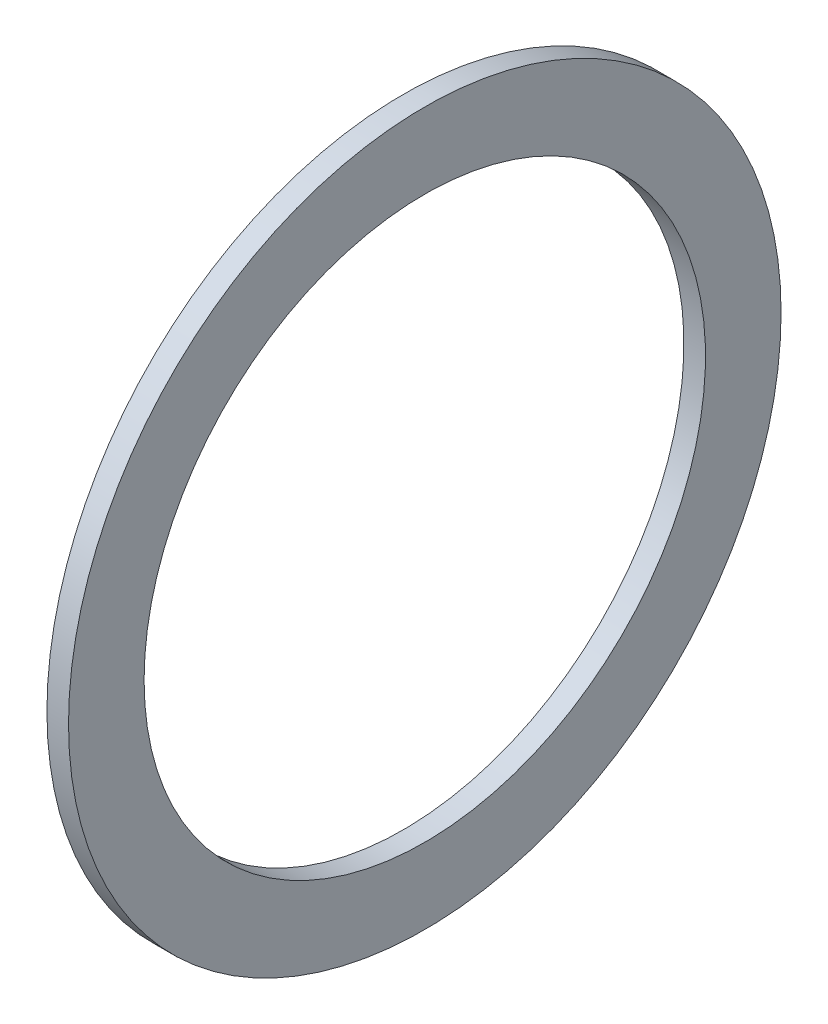
from build123d import *

# Parameters (mm, degrees)
AXIAL_PROFILE_MM_W = 1
AXIAL_PROFILE_MM_H = 3.5


with BuildPart() as part:
    # Axial profile (mm) → Full revolution (revolve)
    with BuildSketch(Plane.XY, mode=Mode.PRIVATE) as full_revolution_sk:
        with Locations((0.5, 14.75)):
            Rectangle(AXIAL_PROFILE_MM_W, AXIAL_PROFILE_MM_H)
    revolve(full_revolution_sk.sketch.rotate(Axis((-110, 0, 0), (1, 0, 0)), 90), axis=Axis((-110, 0, 0), (1, 0, 0)))


solid = part.part
